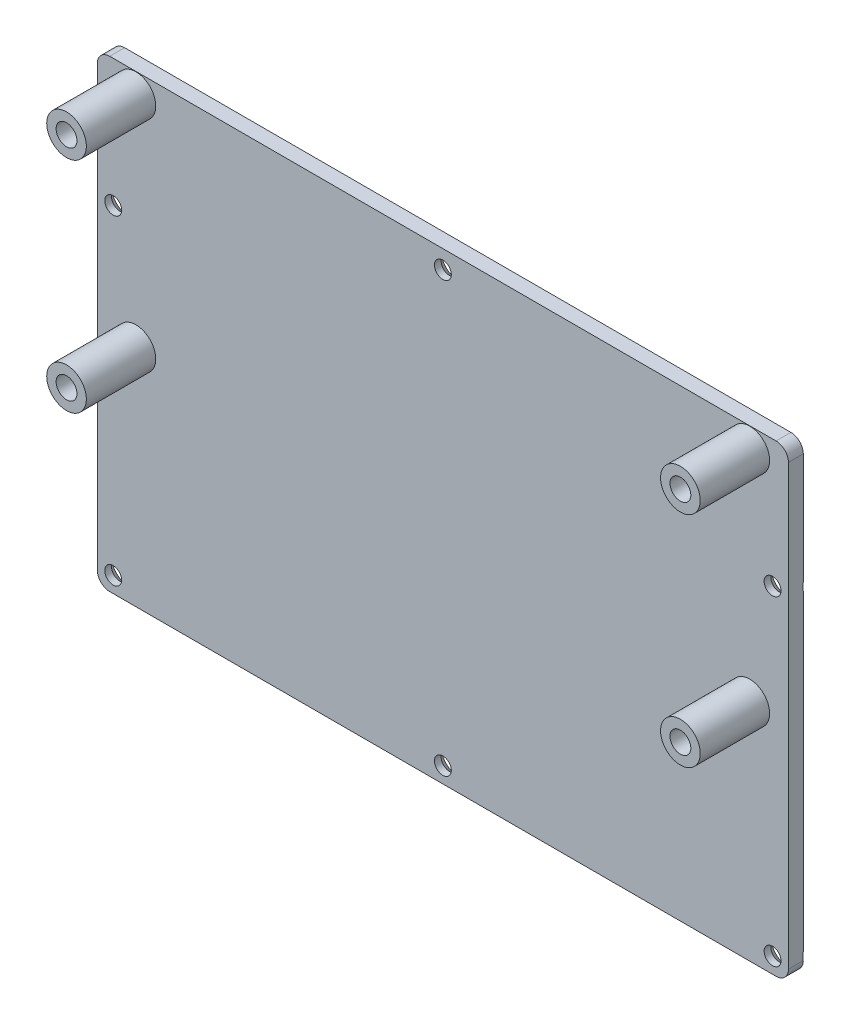
from build123d import *

# Parameters (mm, degrees)
BOSS_EXTRUDE1_DEPTH                               = 3
SKETCH4_W                                         = 7
SKETCH4_H                                         = 4
SKETCH5_W                                         = 7
SKETCH5_H                                         = 4
SKETCH6_W                                         = 7
SKETCH6_H                                         = 4
SKETCH7_W                                         = 7
SKETCH7_H                                         = 4
SKETCH8_W                                         = 4
SKETCH8_H                                         = 14
SKETCH9_W                                         = 4
SKETCH9_H                                         = 14
SKETCH10_W                                        = 4
SKETCH10_H                                        = 14
SKETCH11_W                                        = 4
SKETCH11_H                                        = 14
CSK_FOR_4_FLAT_HEAD_MACHINE_SCREW_100_D           = 3.4
CSK_FOR_4_FLAT_HEAD_MACHINE_SCREW_100_DEPTH       = 17
CSK_FOR_4_FLAT_HEAD_MACHINE_SCREW_100_CSINK_D     = 6.6
CSK_FOR_4_FLAT_HEAD_MACHINE_SCREW_100_CSINK_ANGLE = 88.289805
F_6_CLEARANCE_HOLE1_D                             = 4.2
F_6_CLEARANCE_HOLE1_DEPTH                         = 6
F_3_8_CLEARANCE_HOLE1_D                           = 10.2
F_3_8_CLEARANCE_HOLE1_DEPTH                       = 0.79
FILLET1_R                                         = 1.5
FILLET2_R                                         = 2.5


with BuildPart() as part:
    # Sketch1 → Boss-Extrude1 (new body)
    with BuildSketch(Plane(origin=(0, 0, 0), x_dir=(-1, 0, 0), z_dir=(0, 0, -1))):
        with BuildLine():
            Line((-69.7, 93.82), (-69.7, 71.426225775))
            Line((-69.7, 71.426225775), (-69.7, 69.813774225))
            Line((-69.7, 69.813774225), (-69.7, 6.806225775))
            Line((-69.7, 6.806225775), (-69.7, 5.3))
            ThreePointArc((-69.7, 5.3), (-69.699314773, 5.241470835), (-69.69725947, 5.182973755))
            ThreePointArc((-69.69725947, 5.182973755), (-68.967766953, 3.532233047), (-67.317026245, 2.80274053))
            ThreePointArc((-67.317026245, 2.80274053), (-67.258529165, 2.800685227), (-67.2, 2.8))
            Line((-67.2, 2.8), (-65.693774225, 2.8))
            Line((-65.693774225, 2.8), (-0.806225775, 2.8))
            Line((-0.806225775, 2.8), (0.806225775, 2.8))
            Line((0.806225775, 2.8), (65.693774225, 2.8))
            Line((65.693774225, 2.8), (67.2, 2.8))
            ThreePointArc((67.2, 2.8), (67.258529165, 2.800685227), (67.317026245, 2.80274053))
            ThreePointArc((67.317026245, 2.80274053), (68.967766953, 3.532233047), (69.69725947, 5.182973755))
            ThreePointArc((69.69725947, 5.182973755), (69.699314773, 5.241470835), (69.7, 5.3))
            Line((69.7, 5.3), (69.7, 6.806225775))
            Line((69.7, 6.806225775), (69.7, 69.813774225))
            Line((69.7, 69.813774225), (69.7, 71.426225775))
            Line((69.7, 71.426225775), (69.7, 93.82))
            Line((69.7, 93.82), (69.7, 96.32))
            Line((69.7, 96.32), (67.2, 96.32))
            Line((67.2, 96.32), (-67.2, 96.32))
            Line((-67.2, 96.32), (-69.7, 96.32))
            Line((-69.7, 96.32), (-69.7, 93.82))
        make_face()
    extrude(amount=-BOSS_EXTRUDE1_DEPTH)

    # Sketch2 → Cut-Revolve1 (revolve, cut)
    with BuildSketch(Plane(origin=(0, 70.62, 0), x_dir=(1, 0, 0), z_dir=(0, 1, 0)), mode=Mode.PRIVATE) as cut_revolve1_sk:
        Polygon((69.800194118, 0.0002), (66.5, 0.0002), (66.5, -3), (68.2, -3), (68.2, -1.648484848), align=None)
    revolve(cut_revolve1_sk.sketch.rotate(Axis((66.5, 70.62, -0.0002), (0, 0, 1)), 14.141110809), axis=Axis((66.5, 70.62, -0.0002), (0, 0, 1)), mode=Mode.SUBTRACT)

    # Sketch3 → Cut-Revolve2 (revolve, cut)
    with BuildSketch(Plane(origin=(0, 70.62, 0), x_dir=(1, 0, 0), z_dir=(0, 1, 0)), mode=Mode.PRIVATE) as cut_revolve2_sk:
        Polygon((-63.199805882, 0.0002), (-66.5, 0.0002), (-66.5, -3), (-64.8, -3), (-64.8, -1.648484848), align=None)
    revolve(cut_revolve2_sk.sketch.rotate(Axis((-66.5, 70.62, -0.0002), (0, 0, 1)), 165.858889766), axis=Axis((-66.5, 70.62, -0.0002), (0, 0, 1)), mode=Mode.SUBTRACT)

    # Sketch4 → Revolve1 (revolve)
    with BuildSketch(Plane(origin=(0, 16, 0), x_dir=(1, 0, 0), z_dir=(0, 1, 0))):
        with Locations((-52.5, 2)):
            Rectangle(SKETCH4_W, SKETCH4_H)
    revolve(axis=Axis((-56, 16, -4.000025), (0, 0, 1)))

    # Sketch5 → Revolve2 (revolve)
    with BuildSketch(Plane(origin=(0, 16, 0), x_dir=(1, 0, 0), z_dir=(0, 1, 0))):
        with Locations((59.5, 2)):
            Rectangle(SKETCH5_W, SKETCH5_H)
    revolve(axis=Axis((56, 16, -4.000025), (0, 0, 1)))

    # Sketch6 → Revolve3 (revolve)
    with BuildSketch(Plane(origin=(0, 82.62, 0), x_dir=(1, 0, 0), z_dir=(0, 1, 0))):
        with Locations((-52.5, 2)):
            Rectangle(SKETCH6_W, SKETCH6_H)
    revolve(axis=Axis((-56, 82.62, -4.000025), (0, 0, 1)))

    # Sketch7 → Revolve4 (revolve)
    with BuildSketch(Plane(origin=(0, 82.62, 0), x_dir=(1, 0, 0), z_dir=(0, 1, 0))):
        with Locations((59.5, 2)):
            Rectangle(SKETCH7_W, SKETCH7_H)
    revolve(axis=Axis((56, 82.62, -4.000025), (0, 0, 1)))

    # Sketch8 → Revolve5 (revolve)
    with BuildSketch(Plane.XZ.offset(-92.256), mode=Mode.PRIVATE) as revolve5_sk:
        with Locations((63.91, 10)):
            Rectangle(SKETCH8_W, SKETCH8_H)
    revolve(revolve5_sk.sketch.rotate(Axis((61.91, 92.256, 17.005), (0, 0, -1)), 180), axis=Axis((61.91, 92.256, 17.005), (0, 0, -1)))

    # Sketch9 → Revolve6 (revolve)
    with BuildSketch(Plane.XZ.offset(-92.256), mode=Mode.PRIVATE) as revolve6_sk:
        with Locations((-59.915, 10)):
            Rectangle(SKETCH9_W, SKETCH9_H)
    revolve(revolve6_sk.sketch.rotate(Axis((-61.915, 92.256, 17.005), (0, 0, -1)), 180), axis=Axis((-61.915, 92.256, 17.005), (0, 0, -1)))

    # Sketch10 → Revolve7 (revolve)
    with BuildSketch(Plane.XZ.offset(-48.06), mode=Mode.PRIVATE) as revolve7_sk:
        with Locations((63.91, 10)):
            Rectangle(SKETCH10_W, SKETCH10_H)
    revolve(revolve7_sk.sketch.rotate(Axis((61.91, 48.06, 17.005), (0, 0, -1)), 180), axis=Axis((61.91, 48.06, 17.005), (0, 0, -1)))

    # Sketch11 → Revolve8 (revolve)
    with BuildSketch(Plane.XZ.offset(-48.06), mode=Mode.PRIVATE) as revolve8_sk:
        with Locations((-59.915, 10)):
            Rectangle(SKETCH11_W, SKETCH11_H)
    revolve(revolve8_sk.sketch.rotate(Axis((-61.915, 48.06, 17.005), (0, 0, -1)), 180), axis=Axis((-61.915, 48.06, 17.005), (0, 0, -1)))

    # CSK for #4 Flat Head Machine Screw (100)1
    with Locations(Plane(origin=(0, 0, 0), x_dir=(-1, 0, 0), z_dir=(0, 0, -1))):
        with Locations((66.5, 6), (0, 6), (-66.5, 6), (0, 92.62)):
            CounterSinkHole(CSK_FOR_4_FLAT_HEAD_MACHINE_SCREW_100_D / 2, CSK_FOR_4_FLAT_HEAD_MACHINE_SCREW_100_CSINK_D / 2, depth=CSK_FOR_4_FLAT_HEAD_MACHINE_SCREW_100_DEPTH, counter_sink_angle=CSK_FOR_4_FLAT_HEAD_MACHINE_SCREW_100_CSINK_ANGLE)

    # #6 Clearance Hole1
    with Locations(Plane.XY.offset(17)):
        with Locations((-61.915, 48.06), (61.91, 48.06), (-61.915, 92.256), (61.91, 92.256)):
            Hole(F_6_CLEARANCE_HOLE1_D / 2, depth=F_6_CLEARANCE_HOLE1_DEPTH)

    # 3/8 Clearance Hole1
    with Locations(Plane(origin=(0, 0, -4), x_dir=(-1, 0, 0), z_dir=(0, 0, -1))):
        with Locations((-56, 82.62), (56, 82.62), (-56, 16), (56, 16)):
            Hole(F_3_8_CLEARANCE_HOLE1_D / 2, depth=F_3_8_CLEARANCE_HOLE1_DEPTH)

    # Fillet1
    fillet1_edges = [part.edges().sort_by_distance(p)[0] for p in [
        (-63, 82.62, -4),
        (49, 82.62, -4),
        (-63, 16, -4),
        (49, 16, -4),
    ]]
    fillet(fillet1_edges, radius=FILLET1_R)

    # Fillet2
    fillet2_edges = [part.edges().sort_by_distance(p)[0] for p in [
        (69.7, 96.32, 1.5),
        (-69.7, 96.32, 1.5),
    ]]
    fillet(fillet2_edges, radius=FILLET2_R)


solid = part.part
